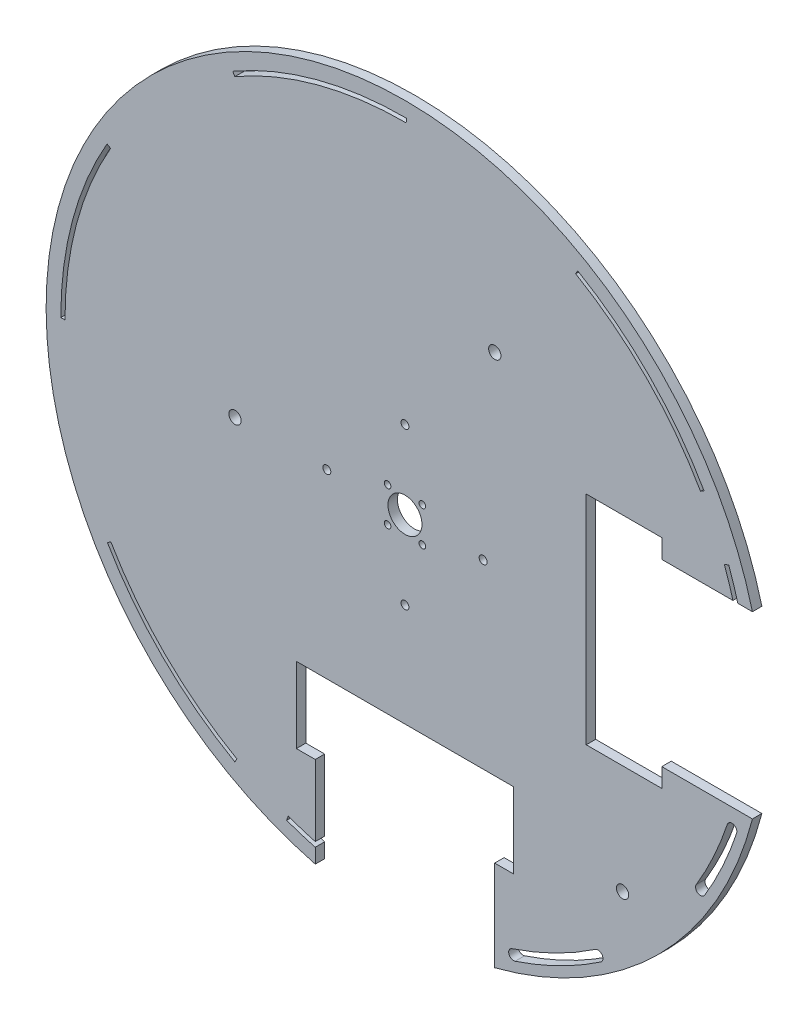
from build123d import *

# Parameters (mm, degrees)
SKETCH1_R           = 3.25
SKETCH1_R_2         = 2.1
SKETCH1_R_3         = 1.75
SKETCH1_R_4         = 9
BOSS_EXTRUDE1_DEPTH = 5


with BuildPart() as part:
    # Sketch1 → Boss-Extrude1 (new body)
    with BuildSketch(Plane.XY):
        with BuildLine():
            Line((47.5, -135.966708945), (47.5, -183.966708945))
            ThreePointArc((47.5, -183.966708945), (134.350288425, -134.350288425), (183.966708945, -47.5))
            Line((183.966708945, -47.5), (135.966708945, -47.5))
            Line((135.966708945, -47.5), (135.966708945, -57.5))
            Line((135.966708945, -57.5), (95.966708945, -57.5))
            Line((95.966708945, -57.5), (95.966708945, 57.5))
            Line((95.966708945, 57.5), (135.966708945, 57.5))
            Line((135.966708945, 57.5), (135.966708945, 47.5))
            Line((135.966708945, 47.5), (173.61955535, 47.5))
            ThreePointArc((173.61955535, 47.5), (171.490271693, 54.690828433), (169.063304941, 61.786721248))
            Line((169.063304941, 61.786721248), (171.411406398, 62.644870154))
            ThreePointArc((171.411406398, 62.644870154), (173.97563055, 55.124676642), (176.210101867, 47.5))
            Line((176.210101867, 47.5), (183.966708945, 47.5))
            ThreePointArc((183.966708945, 47.5), (-134.350288425, 134.350288425), (-47.5, -183.966708945))
            Line((-47.5, -183.966708945), (-47.5, -176.210101867))
            ThreePointArc((-47.5, -176.210101867), (-55.124676642, -173.97563055), (-62.644870154, -171.411406398))
            Line((-62.644870154, -171.411406398), (-61.786721248, -169.063304941))
            ThreePointArc((-61.786721248, -169.063304941), (-54.690828433, -171.490271693), (-47.5, -173.61955535))
            Line((-47.5, -173.61955535), (-47.5, -135.966708945))
            Line((-47.5, -135.966708945), (-57.5, -135.966708945))
            Line((-57.5, -135.966708945), (-57.5, -95.966708945))
            Line((-57.5, -95.966708945), (57.5, -95.966708945))
            Line((57.5, -95.966708945), (57.5, -135.966708945))
            Line((57.5, -135.966708945), (47.5, -135.966708945))
        make_face()
        with Locations((47.553086042, 98.224543307)):
            Circle(SKETCH1_R, mode=Mode.SUBTRACT)
        with BuildLine():
            Line((-90.06771897, 155.845455499), (-91.168546646, 157.750233288))
            ThreePointArc((-91.168546646, 157.750233288), (-46.86549419, 176.069490413), (0.682251823, 182.198722642))
            Line((0.682251823, 182.198722642), (0.674013875, 179.998738066))
            ThreePointArc((0.674013875, 179.998738066), (-46.299610067, 173.943514129), (-90.06771897, 155.845455499))
        make_face(mode=Mode.SUBTRACT)
        with BuildLine():
            ThreePointArc((-155.845455499, 90.06771897), (-173.943514129, 46.299610067), (-179.998738066, -0.674013875))
            Line((-179.998738066, -0.674013875), (-182.198722642, -0.682251823))
            ThreePointArc((-182.198722642, -0.682251823), (-176.069490413, 46.86549419), (-157.750233288, 91.168546646))
            Line((-157.750233288, 91.168546646), (-155.845455499, 90.06771897))
        make_face(mode=Mode.SUBTRACT)
        with BuildLine():
            Line((-88.977505429, -156.470455766), (-90.065008273, -158.382872448))
            ThreePointArc((-90.065008273, -158.382872448), (-128.259298986, -129.407852249), (-157.573663687, -91.473386907))
            Line((-157.573663687, -91.473386907), (-155.671017912, -90.368878394))
            ThreePointArc((-155.671017912, -90.368878394), (-126.710613707, -127.845298599), (-88.977505429, -156.470455766))
        make_face(mode=Mode.SUBTRACT)
        with Locations((-89.999369033, -0.337006938)):
            Circle(SKETCH1_R, mode=Mode.SUBTRACT)
        with Locations((-41.37, 0)):
            Circle(SKETCH1_R_2, mode=Mode.SUBTRACT)
        with Locations((-9.192388155, -9.192388155)):
            Circle(SKETCH1_R_3, mode=Mode.SUBTRACT)
        with BuildLine():
            ThreePointArc((103.668630414, -153.224720813), (81.760900425, -165.952267721), (58.319627193, -175.567141243))
            ThreePointArc((58.319627193, -175.567141243), (55.032569907, -173.919338342), (56.680372807, -170.632281056))
            ThreePointArc((56.680372807, -170.632281056), (79.462756197, -161.287663439), (100.754701342, -148.917863795))
            ThreePointArc((100.754701342, -148.917863795), (104.365094387, -149.614327769), (103.668630414, -153.224720813))
        make_face(mode=Mode.SUBTRACT)
        with Locations((115.206196365, -115.206196365)):
            Circle(SKETCH1_R, mode=Mode.SUBTRACT)
        with Locations((0, -41.37)):
            Circle(SKETCH1_R_2, mode=Mode.SUBTRACT)
        with Locations((9.192388155, -9.192388155)):
            Circle(SKETCH1_R_3, mode=Mode.SUBTRACT)
        Circle(SKETCH1_R_4, mode=Mode.SUBTRACT)
        with Locations((41.37, 0)):
            Circle(SKETCH1_R_2, mode=Mode.SUBTRACT)
        with BuildLine():
            ThreePointArc((175.567141243, -58.319627193), (168.13089268, -77.181622984), (158.67524262, -95.116598864))
            ThreePointArc((158.67524262, -95.116598864), (155.108438361, -96.009855479), (154.215181746, -92.443051221))
            ThreePointArc((154.215181746, -92.443051221), (163.405051373, -75.012193581), (170.632281056, -56.680372807))
            ThreePointArc((170.632281056, -56.680372807), (173.919338342, -55.032569907), (175.567141243, -58.319627193))
        make_face(mode=Mode.SUBTRACT)
        with Locations((-9.192388155, 9.192388155)):
            Circle(SKETCH1_R_3, mode=Mode.SUBTRACT)
        with Locations((9.192388155, 9.192388155)):
            Circle(SKETCH1_R_3, mode=Mode.SUBTRACT)
        with Locations((0, 41.37)):
            Circle(SKETCH1_R_2, mode=Mode.SUBTRACT)
        with BuildLine():
            ThreePointArc((91.473386907, 157.573663687), (129.407852249, 128.259298986), (158.382872448, 90.065008273))
            Line((158.382872448, 90.065008273), (156.470455766, 88.977505429))
            ThreePointArc((156.470455766, 88.977505429), (127.845298599, 126.710613707), (90.368878394, 155.671017912))
            Line((90.368878394, 155.671017912), (91.473386907, 157.573663687))
        make_face(mode=Mode.SUBTRACT)
    extrude(amount=BOSS_EXTRUDE1_DEPTH)


solid = part.part
